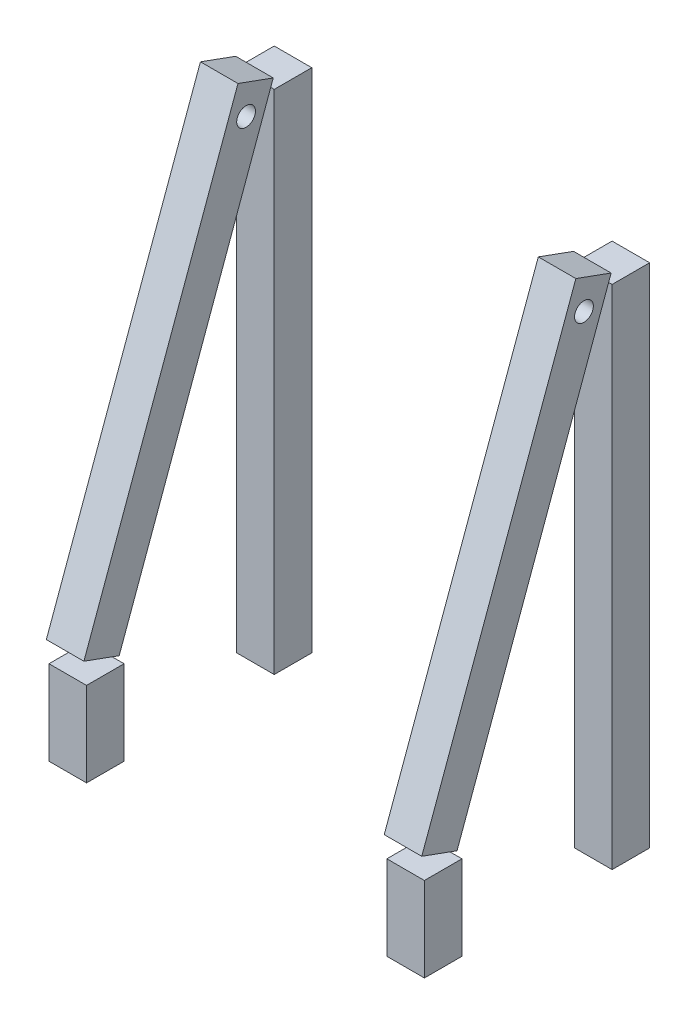
from build123d import *

# Parameters (mm, degrees)
SKETCH1_W             = 50.8
SKETCH1_H             = 50.8
BOSS_EXTRUDE1_DEPTH   = 114.3
BOSS_EXTRUDE1_2_DEPTH = 114.3
BOSS_EXTRUDE1_3_DEPTH = 114.3
BOSS_EXTRUDE1_4_DEPTH = 114.3
SKETCH2_W             = 50.8
SKETCH2_H             = 50.8
BOSS_EXTRUDE2_DEPTH   = 571.5
SKETCH3_R             = 12.7
BOSS_EXTRUDE3_DEPTH   = 50.8
BOSS_EXTRUDE4_START   = -457.2
SKETCH3_3_R           = 12.7
BOSS_EXTRUDE4_DEPTH   = 50.8


with BuildPart() as part:
    # Sketch1 → Boss-Extrude1 (new body)
    with BuildSketch(Plane(origin=(0, 0, 0), x_dir=(1, 0, 0), z_dir=(0, 1, 0))):
        with Locations((228.6, 114.3)):
            Rectangle(SKETCH1_W, SKETCH1_H)
    extrude(amount=BOSS_EXTRUDE1_DEPTH)



with BuildPart() as body_2:
    # Sketch1 → Boss-Extrude1 2 (new body)
    with BuildSketch(Plane(origin=(0, 0, 0), x_dir=(1, 0, 0), z_dir=(0, 1, 0))):
        with Locations((228.6, -139.7)):
            Rectangle(SKETCH1_W, SKETCH1_H)
    extrude(amount=BOSS_EXTRUDE1_2_DEPTH)


with BuildPart() as body_3:
    # Sketch1 → Boss-Extrude1 3 (new body)
    with BuildSketch(Plane(origin=(0, 0, 0), x_dir=(1, 0, 0), z_dir=(0, 1, 0))):
        with Locations((-228.6, 114.3)):
            Rectangle(SKETCH1_W, SKETCH1_H)
    extrude(amount=BOSS_EXTRUDE1_3_DEPTH)


with BuildPart() as body_4:
    # Sketch1 → Boss-Extrude1 4 (new body)
    with BuildSketch(Plane(origin=(0, 0, 0), x_dir=(1, 0, 0), z_dir=(0, 1, 0))):
        with Locations((-228.6, -139.7)):
            Rectangle(SKETCH1_W, SKETCH1_H)
    extrude(amount=BOSS_EXTRUDE1_4_DEPTH)


with BuildPart() as part_1:
    add(part.part)

    add(body_3.part)  # Boss-Extrude2 merges body 3
    # Sketch2 → Boss-Extrude2 (add)
    with BuildSketch(Plane(origin=(0, 114.3, 0), x_dir=(1, 0, 0), z_dir=(0, 1, 0))):
        with Locations((228.6, 114.3)):
            Rectangle(SKETCH2_W, SKETCH2_H)
        with Locations((-228.6, 114.3)):
            Rectangle(SKETCH2_W, SKETCH2_H)
    extrude(amount=BOSS_EXTRUDE2_DEPTH)


with BuildPart() as body_4_2:
    # Sketch3 → Boss-Extrude3 (new body)
    with BuildSketch(Plane(origin=(254, 0, 0), x_dir=(0, 0, -1), z_dir=(1, 0, 0))):
        Polygon((39.825064724, 717.211244912), (87.561449859, 699.836621631), (-120.934029512, 127), (-168.670414648, 144.374623281), align=None)
        with Locations((50.8, 673.1)):
            Circle(SKETCH3_R, mode=Mode.SUBTRACT)
    extrude(amount=-BOSS_EXTRUDE3_DEPTH)


with BuildPart() as body_5:
    # Sketch3<3> → Boss-Extrude4 (new body)
    with BuildSketch(Plane(origin=(254, 0, 0), x_dir=(0, 0, -1), z_dir=(1, 0, 0)).offset(BOSS_EXTRUDE4_START)):
        Polygon((39.825064724, 717.211244912), (87.561449859, 699.836621631), (-120.934029512, 127), (-168.670414648, 144.374623281), align=None)
        with Locations(Location((50.8, 673.1, 0), (0, 0, 180))):
            Circle(SKETCH3_3_R, mode=Mode.SUBTRACT)
    extrude(amount=-BOSS_EXTRUDE4_DEPTH)


solid = Compound([body_2.part, body_4.part, part_1.part, body_4_2.part, body_5.part])
